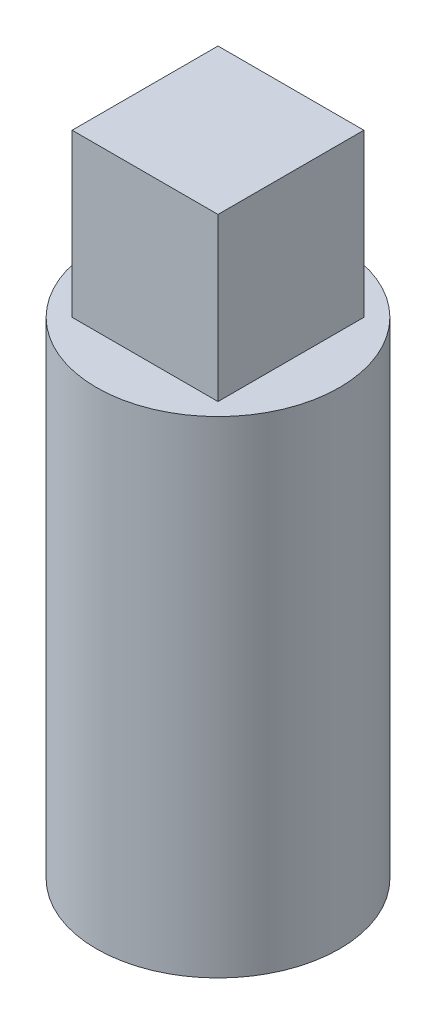
from build123d import *

# Parameters (mm, degrees)
SKETCH1_R           = 1.5
BOSS_EXTRUDE1_DEPTH = 6
BOSS_EXTRUDE3_DEPTH = 2


with BuildPart() as part:
    # Sketch1 → Boss-Extrude1 (new body)
    with BuildSketch(Plane(origin=(0, 0, 0), x_dir=(1, 0, 0), z_dir=(0, 1, 0))):
        with Locations(Location((0, 0, 0), (0, 0, 270))):
            Circle(SKETCH1_R)
    extrude(amount=BOSS_EXTRUDE1_DEPTH)

    # Sketch2 → Boss-Extrude3 (add)
    with BuildSketch(Plane(origin=(0, 6, 0), x_dir=(1, 0, 0), z_dir=(0, 1, 0))):
        Polygon((0, -0.9), (0.9, -0.9), (0.9, 0), (0.9, 0.9), (0, 0.9), (-0.9, 0.9), (-0.9, 0), (-0.9, -0.9), align=None)
    extrude(amount=BOSS_EXTRUDE3_DEPTH)


solid = part.part
